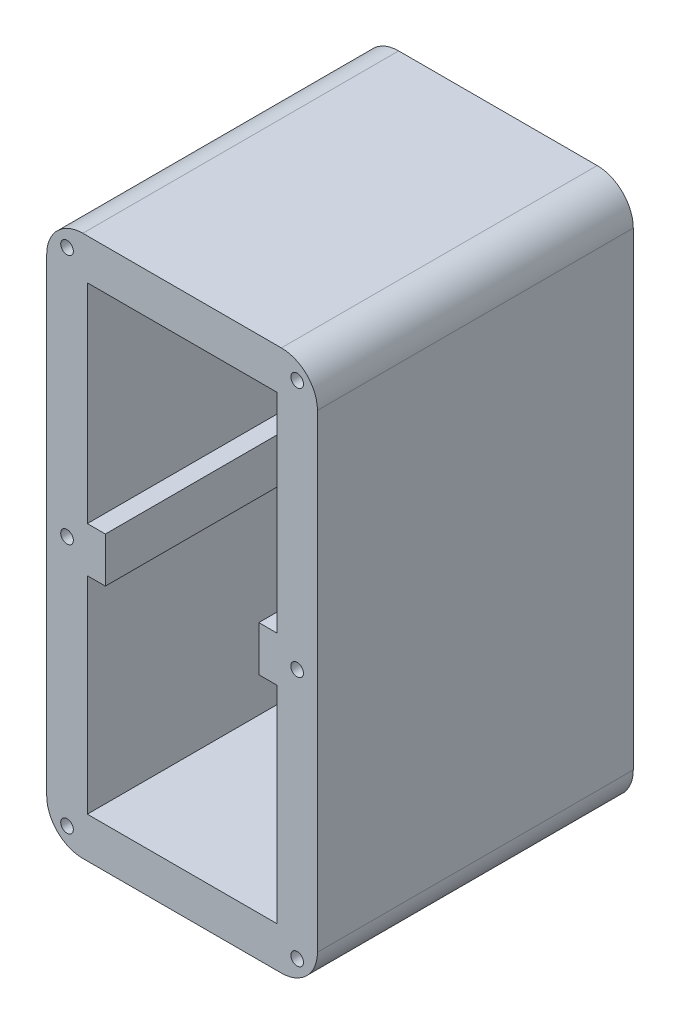
from build123d import *

# Parameters (mm, degrees)
SKETCH1_W           = 60
SKETCH1_H           = 120
SKETCH1_R           = 1.4
BOSS_EXTRUDE1_DEPTH = 70
SKETCH1_5_W         = 4
SKETCH1_5_H         = 10
BOSS_EXTRUDE3_DEPTH = 60
SKETCH1_7_R         = 1.4
BOSS_EXTRUDE5_DEPTH = 62
SKETCH1_8_R         = 1.4
CUT_EXTRUDE1_DEPTH  = 10
FILLET1_R           = 8


with BuildPart() as part:
    # Sketch1 → Boss-Extrude1 (new body)
    with BuildSketch(Plane.XY):
        with Locations((-17, -25.393258427)):
            Rectangle(SKETCH1_W, SKETCH1_H)
        with Locations((-42.5, -80.893258427)):
            Circle(SKETCH1_R, mode=Mode.SUBTRACT)
        with Locations((-42.5, -25.393258427)):
            Circle(SKETCH1_R, mode=Mode.SUBTRACT)
        Polygon((-38, -30.618851522), (-38, -20.618851522), (-38, 25.606741573), (4, 25.606741573), (4, -20.618851522), (4, -30.618851522), (4, -76.393258427), (-38, -76.393258427), align=None, mode=Mode.SUBTRACT)
        with Locations((8.5, -80.893258427)):
            Circle(SKETCH1_R, mode=Mode.SUBTRACT)
        with Locations((8.5, -25.393258427)):
            Circle(SKETCH1_R, mode=Mode.SUBTRACT)
        with Locations((-42.5, 30.106741573)):
            Circle(SKETCH1_R, mode=Mode.SUBTRACT)
        with Locations((8.5, 30.106741573)):
            Circle(SKETCH1_R, mode=Mode.SUBTRACT)
    extrude(amount=-BOSS_EXTRUDE1_DEPTH)

    # Sketch1<5> → Boss-Extrude3 (add)
    with BuildSketch(Plane.XY):
        with Locations((-36, -25.618851522)):
            Rectangle(SKETCH1_5_W, SKETCH1_5_H)
        with Locations((2, -25.618851522)):
            Rectangle(SKETCH1_5_W, SKETCH1_5_H)
    extrude(amount=-BOSS_EXTRUDE3_DEPTH)

    # Sketch1<7> → Boss-Extrude5 (add)
    with BuildSketch(Plane.XY):
        with Locations((8.5, 30.106741573)):
            Circle(SKETCH1_7_R)
        with Locations((-42.5, 30.106741573)):
            Circle(SKETCH1_7_R)
        with Locations((-42.5, -80.893258427)):
            Circle(SKETCH1_7_R)
        with Locations((8.5, -80.893258427)):
            Circle(SKETCH1_7_R)
        with Locations((-42.5, -25.393258427)):
            Circle(SKETCH1_7_R)
        with Locations((8.5, -25.393258427)):
            Circle(SKETCH1_7_R)
    extrude(amount=-BOSS_EXTRUDE5_DEPTH)

    # Sketch1<8> → Cut-Extrude1 (cut)
    with BuildSketch(Plane.XY):
        with Locations((8.5, 30.106741573)):
            Circle(SKETCH1_8_R)
        with Locations((-42.5, 30.106741573)):
            Circle(SKETCH1_8_R)
        with Locations((-42.5, -80.893258427)):
            Circle(SKETCH1_8_R)
        with Locations((8.5, -80.893258427)):
            Circle(SKETCH1_8_R)
        with Locations((-42.5, -25.393258427)):
            Circle(SKETCH1_8_R)
        with Locations((8.5, -25.393258427)):
            Circle(SKETCH1_8_R)
    extrude(amount=-CUT_EXTRUDE1_DEPTH, mode=Mode.SUBTRACT)

    # Fillet1
    fillet1_edges = [part.edges().sort_by_distance(p)[0] for p in [
        (13, -85.393258427, -35),
        (-47, -85.393258427, -35),
        (-47, 34.606741573, -35),
        (13, 34.606741573, -35),
    ]]
    fillet(fillet1_edges, radius=FILLET1_R)


solid = part.part
